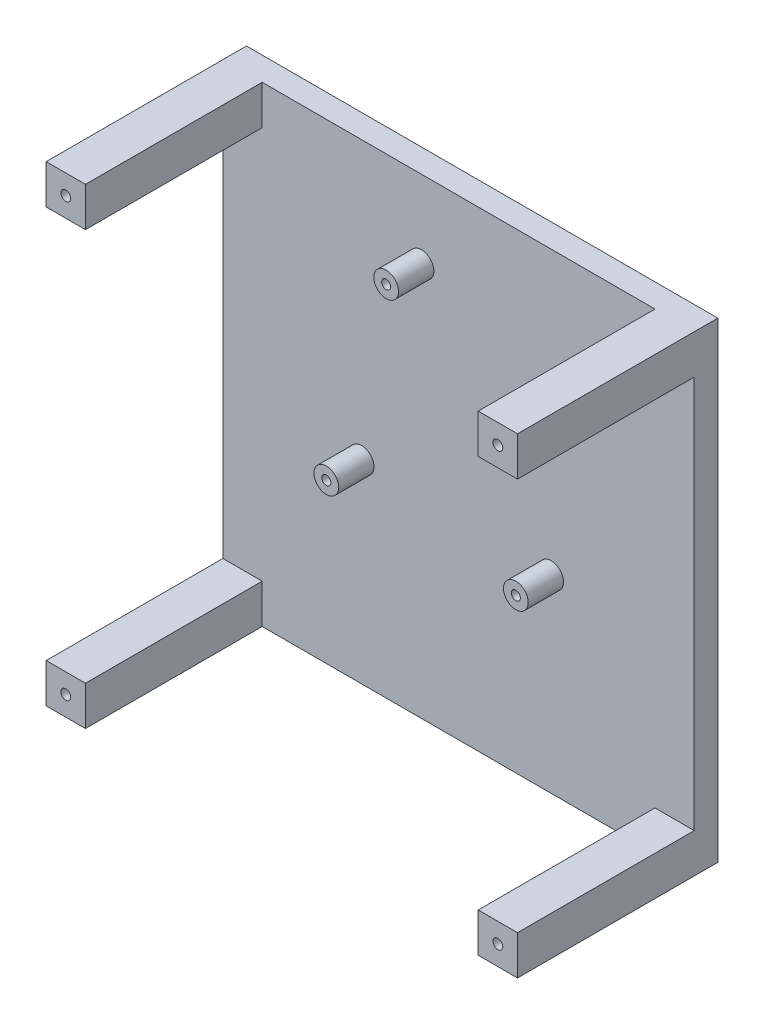
from build123d import *

# Parameters (mm, degrees)
SKETCH1_W                                  = 120
SKETCH1_H                                  = 120
BOSS_EXTRUDE1_DEPTH                        = 6
SKETCH2_W                                  = 10
SKETCH2_H                                  = 10
BOSS_EXTRUDE2_DEPTH                        = 45
SKETCH4_R                                  = 1.25
CUT_EXTRUDE1_DEPTH                         = 14
MIRROR1_AT_THE_SECOND_PLANE_COPY_1_SKETC_R = 1.25
MIRROR1_AT_THE_SECOND_PLANE_COPY_1_DEPTH   = 14
SKETCH5_R                                  = 3.15
BOSS_EXTRUDE4_DEPTH                        = 9
SKETCH7_R                                  = 1.15
CUT_EXTRUDE2_DEPTH                         = 9


with BuildPart() as part:
    # Sketch1 → Boss-Extrude1 (new body)
    with BuildSketch(Plane(origin=(0, 0, 0), x_dir=(0, 1, 0), z_dir=(0, 0, 1))):
        Rectangle(SKETCH1_W, SKETCH1_H)
    extrude(amount=BOSS_EXTRUDE1_DEPTH)

    # Sketch2 → Boss-Extrude2 (add)
    with BuildSketch(Plane.XY.offset(6)):
        with Locations((-55, 55)):
            Rectangle(SKETCH2_W, SKETCH2_H)
        with Locations((55, 55)):
            Rectangle(SKETCH2_W, SKETCH2_H)
        with Locations((55, -55)):
            Rectangle(SKETCH2_W, SKETCH2_H)
        with Locations((-55, -55)):
            Rectangle(SKETCH2_W, SKETCH2_H)
    extrude(amount=BOSS_EXTRUDE2_DEPTH)

    # Sketch4 → Cut-Extrude1 (cut)
    with BuildSketch(Plane.XY.offset(51)):
        with Locations((-55, 55)):
            Circle(SKETCH4_R)
    cut_extrude1 = extrude(amount=-CUT_EXTRUDE1_DEPTH, mode=Mode.SUBTRACT)

    # Mirror1: Cut-Extrude1 across plane
    add(cut_extrude1.mirror(Plane.ZX), mode=Mode.SUBTRACT)

    # Mirror1 at the second plane: Cut-Extrude1 across plane
    add(cut_extrude1.mirror(Plane(origin=(0, 0, 0), x_dir=(0, 0, 1), z_dir=(1, 0, 0))), mode=Mode.SUBTRACT)

    # Mirror1 at the second plane copy 1 sketc → Mirror1 at the second plane copy 1 (cut)
    with BuildSketch(Plane(origin=(0, 0, 51), x_dir=(-1, 0, 0), z_dir=(0, 0, 1))):
        with Locations((-55, 55)):
            Circle(MIRROR1_AT_THE_SECOND_PLANE_COPY_1_SKETC_R)
    extrude(amount=-MIRROR1_AT_THE_SECOND_PLANE_COPY_1_DEPTH, mode=Mode.SUBTRACT)

    # Sketch5 → Boss-Extrude4 (add)
    with BuildSketch(Plane.XY.offset(6)):
        with Locations(Location((-9.440556716, 40.216124503, 0), (0, 0, 180))):
            Circle(SKETCH5_R)
        with Locations(Location((-24.680556716, -10.583875497, 0), (0, 0, 180))):
            Circle(SKETCH5_R)
        with Locations(Location((23.579443284, -11.853875497, 0), (0, 0, 180))):
            Circle(SKETCH5_R)
    extrude(amount=BOSS_EXTRUDE4_DEPTH)

    # Sketch7 → Cut-Extrude2 (cut)
    with BuildSketch(Plane(origin=(0, 0, 15), x_dir=(0, -1, 0), z_dir=(0, 0, 1))):
        with Locations(Location((-40.216124503, -9.440556716, 0), (0, 0, 90))):
            Circle(SKETCH7_R)
        with Locations(Location((11.853875497, 23.579443284, 0), (0, 0, 90))):
            Circle(SKETCH7_R)
        with Locations(Location((10.583875497, -24.680556716, 0), (0, 0, 90))):
            Circle(SKETCH7_R)
    extrude(amount=-CUT_EXTRUDE2_DEPTH, mode=Mode.SUBTRACT)


solid = part.part
